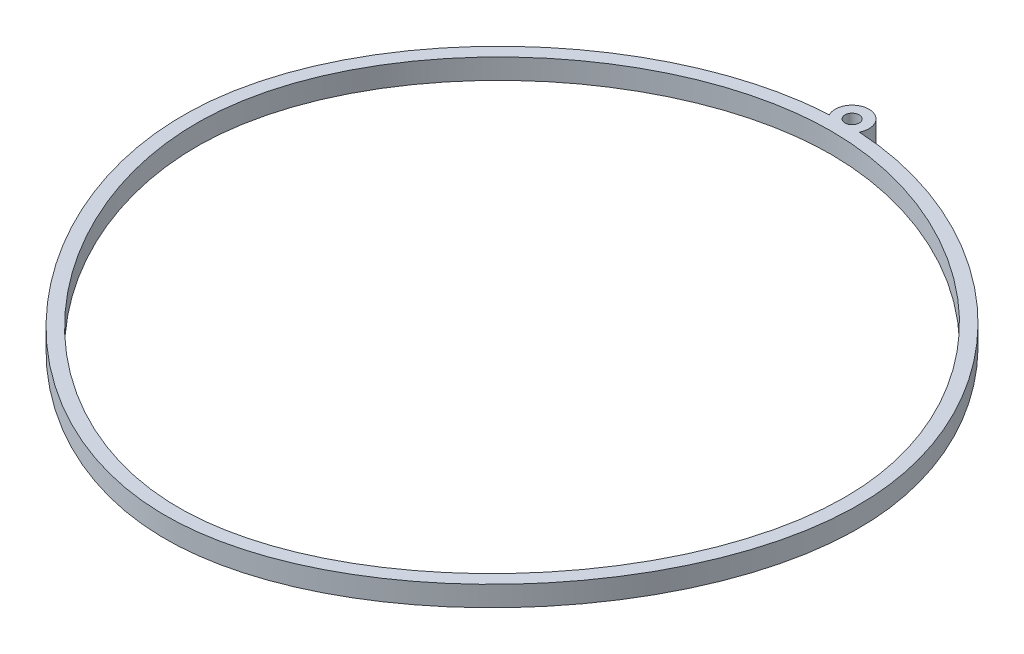
from build123d import *

# Parameters (mm, degrees)
SKETCH1_R           = 1.05
BOSS_EXTRUDE1_DEPTH = 3


with BuildPart() as part:
    # Sketch1 → Boss-Extrude1 (new body)
    # profile 1 of 2: a face of its own
    with BuildSketch(Plane(origin=(0, 0, 0), x_dir=(1, 0, 0), z_dir=(0, 1, 0))):
        with BuildLine():
            add(Edge.make_bspline(
                [(0, 45.4304), (0.738405562, 45.4304), (1.476811125, 45.410204053), (2.214570802, 45.370367171)],
                knots=[0, 0, 0, 0, 0.007270955, 0.007270955, 0.007270955, 0.007270955], degree=3))
            ThreePointArc((2.214570802, 45.370367171), (0, 49.0304), (-2.214570802, 45.370367171))
            add(Edge.make_bspline(
                [(-2.214570802, 45.370367171), (-1.476811125, 45.410204053), (-0.738405562, 45.4304), (0, 45.4304)],
                knots=[0.992729045, 0.992729045, 0.992729045, 0.992729045, 1, 1, 1, 1], degree=3))
        make_face()
        with Locations(Location((0, 46.5304, 0), (0, 0, 270))):
            Circle(SKETCH1_R, mode=Mode.SUBTRACT)
    # profile 2 of 2: a face of its own
    with BuildSketch(Plane(origin=(0, 0, 0), x_dir=(1, 0, 0), z_dir=(0, 1, 0))):
        with BuildLine():
            add(Edge.make_bspline(
                [(0, 45.4304), (24.163068627, 45.4304), (74.940823398, -0.016041509), (0, -83.943698437), (-74.940823398, -0.016041509), (-24.163068627, 45.4304), (0, 45.4304)],
                knots=[0, 0, 0, 0, 0.237929668, 0.5, 0.762070332, 1, 1, 1, 1], degree=3))
        make_face()
        with BuildLine():
            add(Edge.make_bspline(
                [(0, 43.4304), (23.164683238, 43.4304), (71.947282513, -0.015737083), (0, -80.948848585), (-71.947282513, -0.015737083), (-23.164683238, 43.4304), (0, 43.4304)],
                knots=[0, 0, 0, 0, 0.237427726, 0.5, 0.762572274, 1, 1, 1, 1], degree=3))
        make_face(mode=Mode.SUBTRACT)
    extrude(amount=BOSS_EXTRUDE1_DEPTH)


solid = part.part
